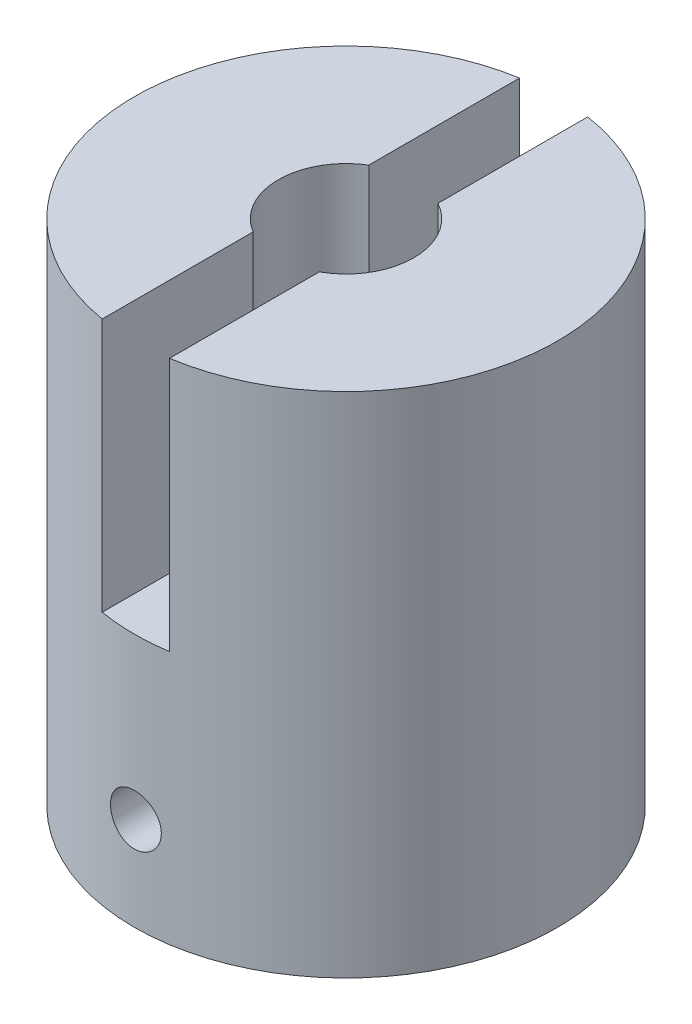
from build123d import *

# Parameters (mm, degrees)
CROQUIS1_R              = 12.5
SALIENTE_EXTRUIR1_DEPTH = 30
CORTAR_EXTRUIR1_DEPTH   = 15
CROQUIS3_R              = 3.5
CORTAR_EXTRUIR2_DEPTH   = 15
CROQUIS4_R              = 1.5
CORTAR_EXTRUIR3_DEPTH   = 15


with BuildPart() as part:
    # Croquis1 → Saliente-Extruir1 (new body)
    with BuildSketch(Plane(origin=(0, 0, 0), x_dir=(1, 0, 0), z_dir=(0, 1, 0))):
        with Locations(Location((0, 0, 0), (0, 0, 270))):
            Circle(CROQUIS1_R)
    extrude(amount=SALIENTE_EXTRUIR1_DEPTH)

    # Croquis2 → Cortar-Extruir1 (cut)
    with BuildSketch(Plane(origin=(0, 30, 0), x_dir=(1, 0, 0), z_dir=(0, 1, 0))):
        with BuildLine():
            Line((-2.073774887, 3.420447006), (-2.073774887, 12.856138783))
            Line((-2.073774887, 12.856138783), (1.926225113, 12.856138783))
            Line((1.926225113, 12.856138783), (1.926225113, 3.505660681))
            ThreePointArc((1.926225113, 3.505660681), (4, 0), (1.926225113, -3.505660681))
            Line((1.926225113, -3.505660681), (1.926225113, -12.772374377))
            Line((1.926225113, -12.772374377), (-2.073774887, -12.772374377))
            Line((-2.073774887, -12.772374377), (-2.073774887, -3.420447006))
            ThreePointArc((-2.073774887, -3.420447006), (-4, 0), (-2.073774887, 3.420447006))
        make_face()
    extrude(amount=-CORTAR_EXTRUIR1_DEPTH, mode=Mode.SUBTRACT)

    # Croquis3 → Cortar-Extruir2 (cut)
    with BuildSketch(Plane.XZ):
        with Locations(Location((0, 0, 0), (0, 0, 270))):
            Circle(CROQUIS3_R)
    extrude(amount=-CORTAR_EXTRUIR2_DEPTH, mode=Mode.SUBTRACT)

    # Croquis4 → Cortar-Extruir3 (cut)
    with BuildSketch(Plane.XY.offset(15)):
        with Locations((0, 5.510659623)):
            Circle(CROQUIS4_R)
    extrude(amount=-CORTAR_EXTRUIR3_DEPTH, mode=Mode.SUBTRACT)


solid = part.part
